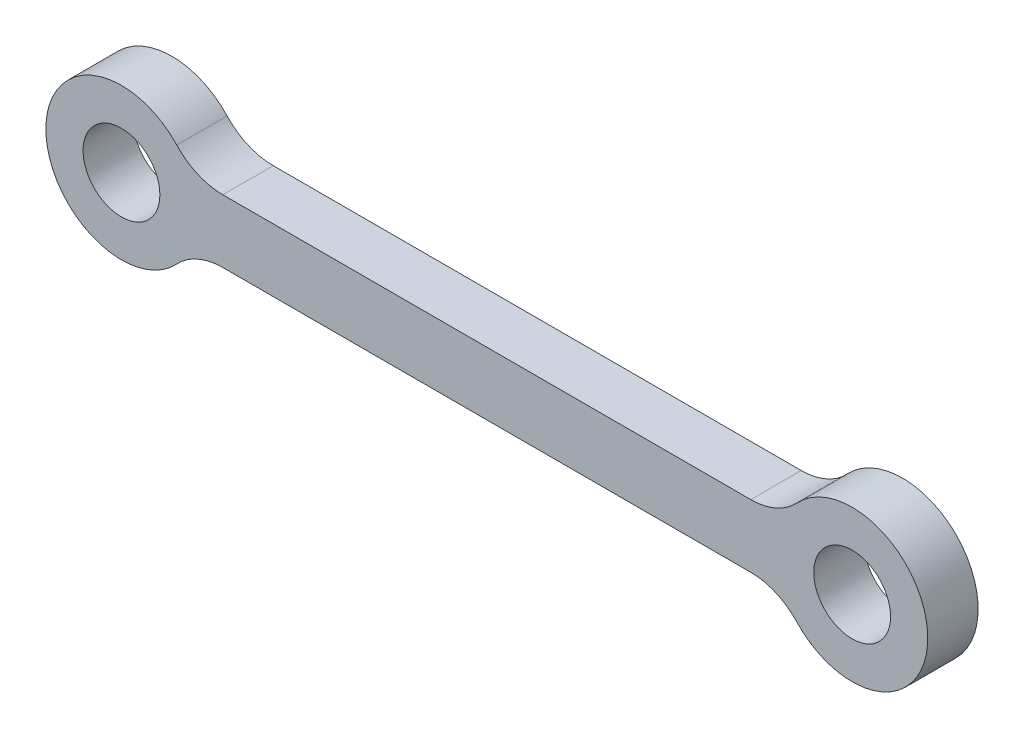
from build123d import *
from build123d.topology import SkipClean

# Parameters (mm, degrees)
SKETCH_1_R          = 3.05
EXTRUDE_1_DEPTH     = 2
CUT_EXTRUDE_1_DEPTH = 4.2
FILLET_1_R          = 5


with BuildPart() as part:
    # 草图1 → 凸台-拉伸1 (new, symmetric)
    with BuildSketch(Plane.XY):
        with BuildLine():
            Line((-29, -6), (29, -6))
            ThreePointArc((29, -6), (35, 0), (29, 6))
            Line((29, 6), (-29, 6))
            ThreePointArc((-29, 6), (-35, 0), (-29, -6))
        make_face()
        with Locations((-29, 0)):
            Circle(SKETCH_1_R, mode=Mode.SUBTRACT)
        with Locations((29, 0)):
            Circle(SKETCH_1_R, mode=Mode.SUBTRACT)
    extrude(amount=EXTRUDE_1_DEPTH, both=True)

    # 草图2 → 切除-拉伸1 (cut)
    with SkipClean():  # the faces are left unmerged after this step: merging them gives an invalid solid
        with BuildSketch(Plane.XY.offset(2)):
            with BuildLine():
                Line((23.545643943, -2.5), (-23.545643943, -2.5))
                ThreePointArc((-23.545643943, -2.5), (-25.759629651, -5.049752469), (-29, -6))
                Line((-29, -6), (29, -6))
                ThreePointArc((29, -6), (25.759629651, -5.049752469), (23.545643943, -2.5))
            make_face()
            with BuildLine():
                ThreePointArc((-29, 6), (-25.759629651, 5.049752469), (-23.545643943, 2.5))
                Line((-23.545643943, 2.5), (23.545643943, 2.5))
                ThreePointArc((23.545643943, 2.5), (25.759629651, 5.049752469), (29, 6))
                Line((29, 6), (-29, 6))
            make_face()
        extrude(amount=-CUT_EXTRUDE_1_DEPTH, mode=Mode.SUBTRACT)

    # 圆角1
    fillet_1_edges = [part.edges().sort_by_distance(p)[0] for p in [
        (-23.545643943, -2.5, 0),
        (23.545643943, -2.5, 0),
        (-23.545643943, 2.5, 0),
        (23.545643943, 2.5, 0),
    ]]
    fillet(fillet_1_edges, radius=FILLET_1_R)


solid = part.part
